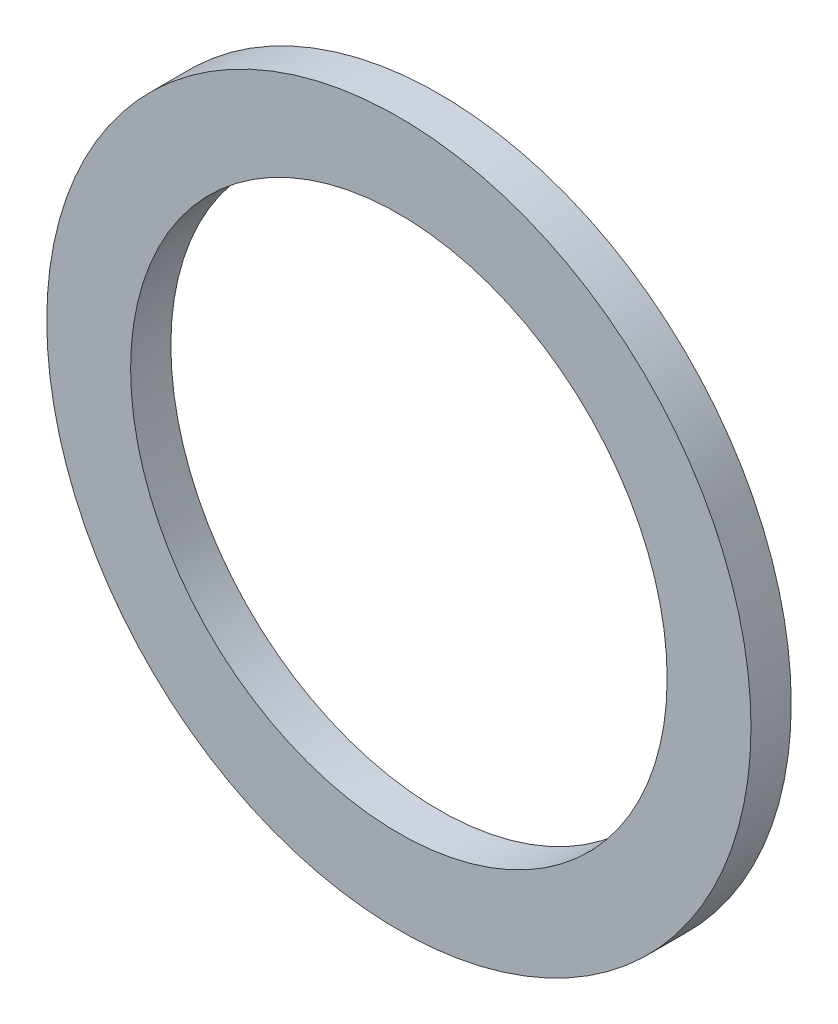
from build123d import *

# Parameters (mm, degrees)
SKETCH_1_R      = 52.5
SKETCH_1_R_2    = 40
EXTRUDE_1_DEPTH = 6


with BuildPart() as part:
    # 草图1 → 凸台-拉伸1 (new body)
    with BuildSketch(Plane.XY):
        Circle(SKETCH_1_R)
        Circle(SKETCH_1_R_2, mode=Mode.SUBTRACT)
    extrude(amount=EXTRUDE_1_DEPTH)


solid = part.part
